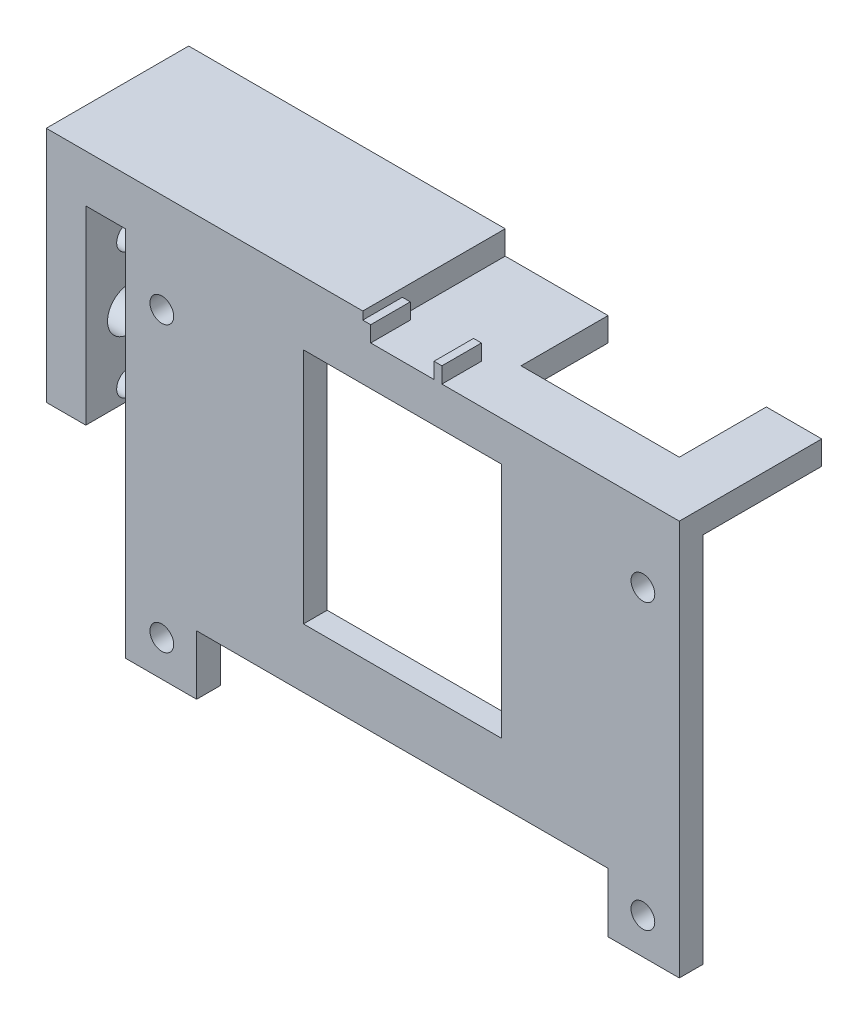
from build123d import *

# Parameters (mm, degrees)
SKETCH_1_R          = 1.5
EXTRUDE_1_DEPTH     = 3
SKETCH_2_W          = 70
SKETCH_2_H          = 22
EXTRUDE_2_DEPTH     = 3
SKETCH_3_W          = 20
SKETCH_3_H          = 21.549001307
CUT_EXTRUDE_1_DEPTH = 3
SKETCH_4_W          = 1
SKETCH_4_H          = 2
EXTRUDE_3_DEPTH     = 5
SKETCH_5_W          = 40
SKETCH_5_H          = 25
EXTRUDE_4_DEPTH     = 3
SKETCH_6_W          = 79.808748454
SKETCH_6_H          = 4
CUT_EXTRUDE_2_DEPTH = 5
SKETCH_7_W          = 5
SKETCH_7_H          = 25
EXTRUDE_5_DEPTH     = 30
SKETCH_8_R          = 2.75
SKETCH_8_R_2        = 1.6
CUT_EXTRUDE_3_DEPTH = 5
SKETCH_9_W          = 5
SKETCH_9_H          = 25
EXTRUDE_6_DEPTH     = 3
SKETCH_10_W         = 7
SKETCH_10_H         = 39.176748617
CUT_EXTRUDE_4_DEPTH = 53.490475326


with BuildPart() as part:
    # 草图1 → 凸台-拉伸1 (new body)
    # profile 1 of 2: a face of its own
    with BuildSketch(Plane.XY):
        Polygon((26, -22.5), (35, -22.5), (35, 22.5), (12.5, 22.5), (12.5, -7.5), (-12.5, -7.5), (-12.5, 22.5), (-35, 22.5), (-35, -22.5), (-26, -22.5), (-26, -15), (26, -15), align=None)
        with Locations((-30.4, -17.95)):
            Circle(SKETCH_1_R, mode=Mode.SUBTRACT)
        with Locations((30.4, -17.95)):
            Circle(SKETCH_1_R, mode=Mode.SUBTRACT)
        with Locations((-30.4, 17.95)):
            Circle(SKETCH_1_R, mode=Mode.SUBTRACT)
        with Locations((30.4, 17.95)):
            Circle(SKETCH_1_R, mode=Mode.SUBTRACT)
    # profile 2 of 2: a face of its own
    with BuildSketch(Plane.XY):
        Polygon((12.5, 22.5), (35, 22.5), (35, 24.5), (-35, 24.5), (-35, 22.5), (-12.5, 22.5), align=None)
    extrude(amount=EXTRUDE_1_DEPTH)

    # 草图2 → 凸台-拉伸2 (add)
    with BuildSketch(Plane(origin=(0, 24.5, 0), x_dir=(1, 0, 0), z_dir=(0, 1, 0))):
        with Locations((0, 8)):
            Rectangle(SKETCH_2_W, SKETCH_2_H)
    extrude(amount=EXTRUDE_2_DEPTH)

    # 草图3 → 切除-拉伸1 (cut)
    with BuildSketch(Plane(origin=(0, 27.5, 0), x_dir=(1, 0, 0), z_dir=(0, 1, 0))):
        with Locations((18, 14.774500654)):
            Rectangle(SKETCH_3_W, SKETCH_3_H)
    extrude(amount=-CUT_EXTRUDE_1_DEPTH, mode=Mode.SUBTRACT)

    # 草图4 → 凸台-拉伸3 (add)
    with BuildSketch(Plane.XY.offset(3)):
        with Locations((4.5, 28.5)):
            Rectangle(SKETCH_4_W, SKETCH_4_H)
        with Locations((-4.5, 28.5)):
            Rectangle(SKETCH_4_W, SKETCH_4_H)
    extrude(amount=-EXTRUDE_3_DEPTH)

    # 草图5 → 凸台-拉伸4 (add)
    with BuildSketch(Plane(origin=(0, 27.5, 0), x_dir=(1, 0, 0), z_dir=(0, 1, 0))):
        with Locations((-25, 2.5)):
            Rectangle(SKETCH_5_W, SKETCH_5_H)
    extrude(amount=EXTRUDE_4_DEPTH)

    # 草图6 → 切除-拉伸2 (cut)
    with BuildSketch(Plane(origin=(0, 27.5, 0), x_dir=(1, 0, 0), z_dir=(0, 1, 0))):
        with Locations((4.904374227, 17)):
            Rectangle(SKETCH_6_W, SKETCH_6_H)
    extrude(amount=-CUT_EXTRUDE_2_DEPTH, mode=Mode.SUBTRACT)

    # 草图7 → 凸台-拉伸5 (add)
    with BuildSketch(Plane(origin=(0, 30.5, 0), x_dir=(1, 0, 0), z_dir=(0, 1, 0))):
        with Locations((-42.5, 2.5)):
            Rectangle(SKETCH_7_W, SKETCH_7_H)
    extrude(amount=-EXTRUDE_5_DEPTH)

    # 草图8 → 切除-拉伸3 (cut)
    with BuildSketch(Plane.ZY.offset(45)):
        with Locations((-2.5, 10.5)):
            Circle(SKETCH_8_R)
        with Locations((-2.5, 18.5)):
            Circle(SKETCH_8_R_2)
        with Locations((5.5, 10.5)):
            Circle(SKETCH_8_R_2)
        with Locations((-2.5, 2.5)):
            Circle(SKETCH_8_R_2)
        with Locations((-10.5, 10.5)):
            Circle(SKETCH_8_R_2)
    extrude(amount=-CUT_EXTRUDE_3_DEPTH, mode=Mode.SUBTRACT)

    # 草图9 → 凸台-拉伸6 (add)
    with BuildSketch(Plane.XZ.offset(-27.5)):
        with Locations((-37.5, -2.5)):
            Rectangle(SKETCH_9_W, SKETCH_9_H)
    extrude(amount=EXTRUDE_6_DEPTH)

    # 草图10 → 切除-拉伸4 (cut, through all)
    with BuildSketch(Plane(origin=(-5, 0, 0), x_dir=(0, 0, -1), z_dir=(1, 0, 0))):
        with Locations((-6.5, 10.911625692)):
            Rectangle(SKETCH_10_W, SKETCH_10_H)
    extrude(amount=-CUT_EXTRUDE_4_DEPTH, mode=Mode.SUBTRACT)


solid = part.part
